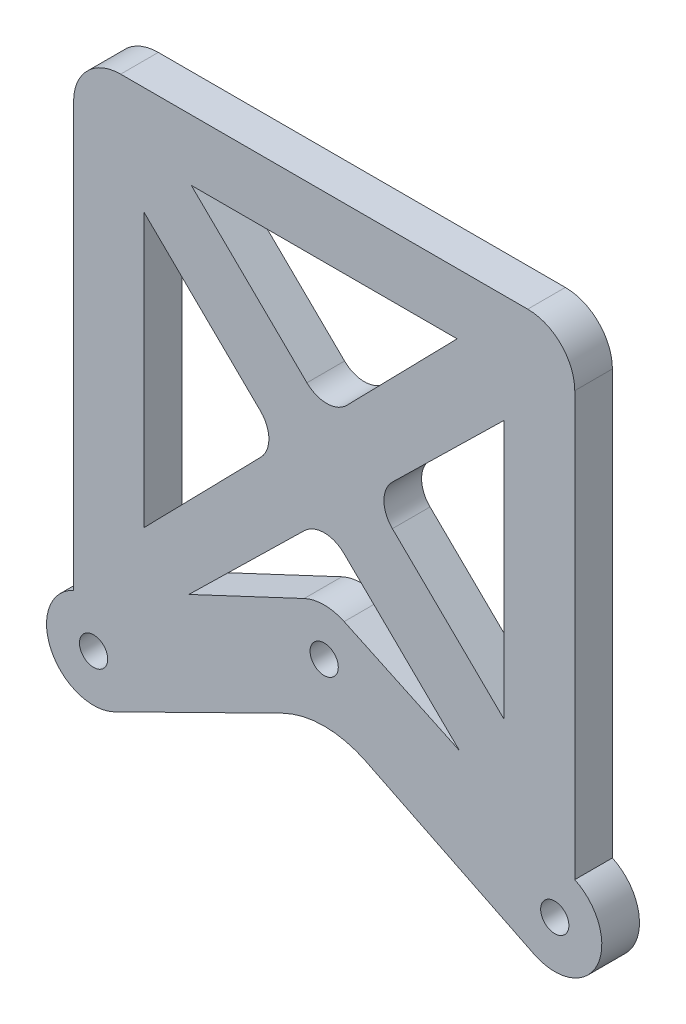
from build123d import *

# Parameters (mm, degrees)
SKETCH1_R           = 1.5
BOSS_EXTRUDE1_DEPTH = 4


with BuildPart() as part:
    # Sketch1 → Boss-Extrude1 (new body)
    with BuildSketch(Plane.XY):
        with BuildLine():
            ThreePointArc((-26.624535685, -6.97381528), (-29.02618472, -13.624535685), (-22.375464315, -16.02618472))
            Line((-22.375464315, -16.02618472), (-22.205082013, -15.942223704))
            Line((-22.205082013, -15.942223704), (-4.420251148, -7.178212035))
            ThreePointArc((-4.420251148, -7.178212035), (0, -6.148238779), (4.420251148, -7.178212035))
            Line((4.420251148, -7.178212035), (22.205082013, -15.942223704))
            Line((22.205082013, -15.942223704), (22.375464315, -16.02618472))
            ThreePointArc((22.375464315, -16.02618472), (29.02618472, -13.624535685), (26.624535685, -6.97381528))
            Line((26.624535685, -6.97381528), (26.624535685, 38.02618472))
            ThreePointArc((26.624535685, 38.02618472), (25.160069591, 41.561718626), (21.624535685, 43.02618472))
            Line((21.624535685, 43.02618472), (-21.624535685, 43.02618472))
            ThreePointArc((-21.624535685, 43.02618472), (-25.160069591, 41.561718626), (-26.624535685, 38.02618472))
            Line((-26.624535685, 38.02618472), (-26.624535685, -6.97381528))
        make_face()
        with Locations((-24.5, -11.5)):
            Circle(SKETCH1_R, mode=Mode.SUBTRACT)
        with Locations((24.5, -11.5)):
            Circle(SKETCH1_R, mode=Mode.SUBTRACT)
        Circle(SKETCH1_R, mode=Mode.SUBTRACT)
        with BuildLine():
            Line((14.374535685, -1.22381528), (2.124535685, 4.52618472))
            ThreePointArc((2.124535685, 4.52618472), (0, 5), (-2.124535685, 4.52618472))
            Line((-2.124535685, 4.52618472), (-14.374535685, -1.22381528))
            Line((-14.374535685, -1.22381528), (-2.097868645, 10.785812849))
            ThreePointArc((-2.097868645, 10.785812849), (0, 11.641297251), (2.097868645, 10.785812849))
            Line((2.097868645, 10.785812849), (14.374535685, -1.22381528))
        make_face(mode=Mode.SUBTRACT)
        with BuildLine():
            Line((-6.73171968, 15.226590291), (-19.124535685, 2.558215038))
            Line((-19.124535685, 2.558215038), (-19.124535685, 31.546592884))
            Line((-19.124535685, 31.546592884), (-6.778366633, 19.468974534))
            ThreePointArc((-6.778366633, 19.468974534), (-5.876416612, 17.357443313), (-6.73171968, 15.226590291))
        make_face(mode=Mode.SUBTRACT)
        with BuildLine():
            Line((19.124535685, 31.546592884), (19.124535685, 4.020746784))
            Line((19.124535685, 4.020746784), (7.24778827, 15.639154236))
            ThreePointArc((7.24778827, 15.639154236), (6.345656915, 17.783669834), (7.24778827, 19.928185432))
            Line((7.24778827, 19.928185432), (19.124535685, 31.546592884))
        make_face(mode=Mode.SUBTRACT)
        with BuildLine():
            Line((-1.833941699, 24.523340745), (-14.124535685, 36.546592884))
            Line((-14.124535685, 36.546592884), (14.124535685, 36.546592884))
            Line((14.124535685, 36.546592884), (2.408442543, 24.569987698))
            ThreePointArc((2.408442543, 24.569987698), (0.296911322, 23.668037677), (-1.833941699, 24.523340745))
        make_face(mode=Mode.SUBTRACT)
    extrude(amount=BOSS_EXTRUDE1_DEPTH)


solid = part.part
